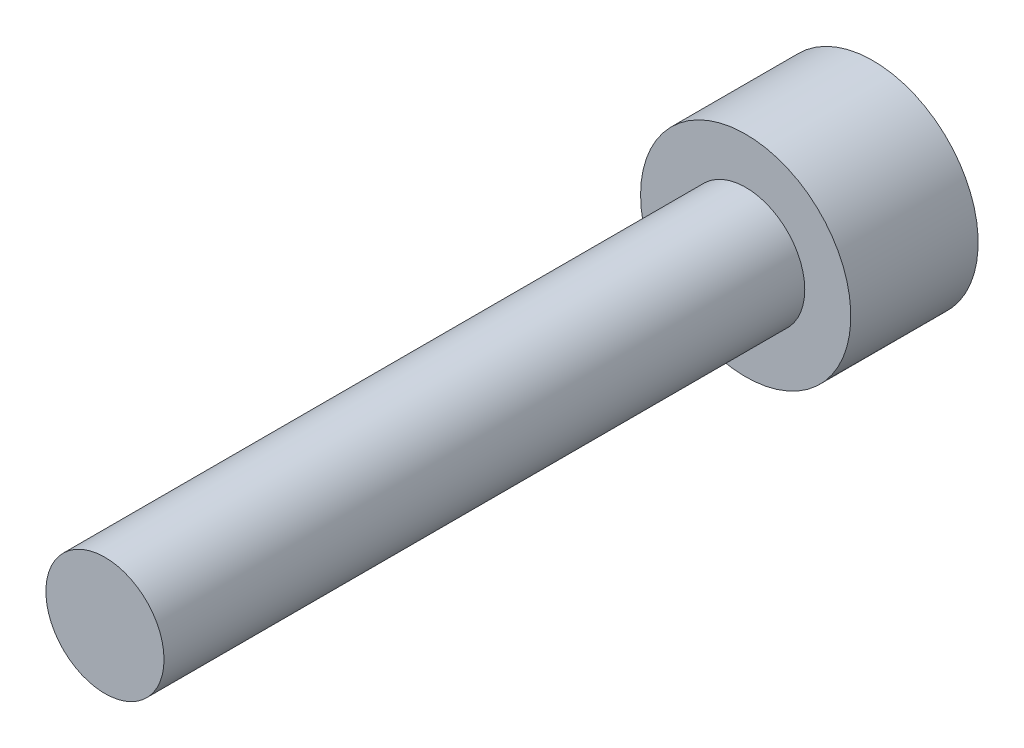
from build123d import *

# Parameters (mm, degrees)
SKETCH1_R           = 2.625
BOSS_EXTRUDE1_DEPTH = 3.18
SKETCH2_R           = 1.475
BOSS_EXTRUDE2_DEPTH = 16


with BuildPart() as part:
    # Sketch1 → Boss-Extrude1 (new body)
    with BuildSketch(Plane.XY):
        with Locations(Location((0, 0, 0), (0, 0, 180))):
            Circle(SKETCH1_R)
    extrude(amount=BOSS_EXTRUDE1_DEPTH)

    # Sketch2 → Boss-Extrude2 (add)
    with BuildSketch(Plane.XY.offset(3.18)):
        Circle(SKETCH2_R)
    extrude(amount=BOSS_EXTRUDE2_DEPTH)


solid = part.part
